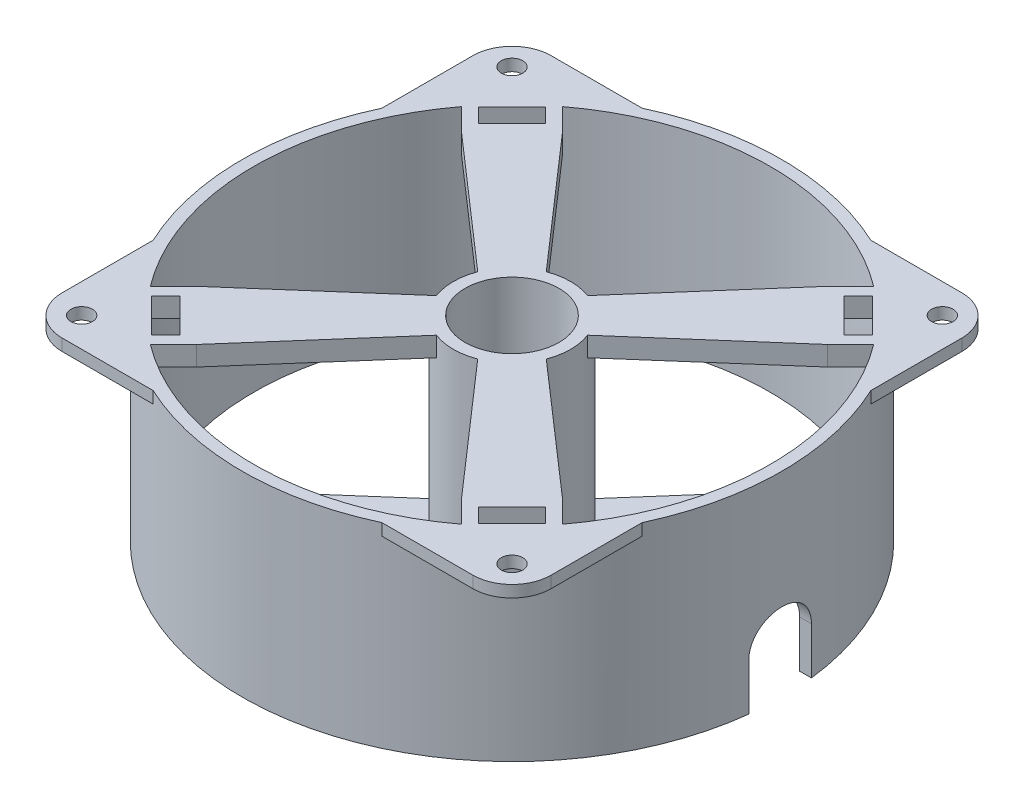
from build123d import *

# Parameters (mm, degrees)
SKETCH1_R               = 69
BOSS_EXTRUDE1_DEPTH     = 50
SKETCH2_W               = 125
SKETCH2_H               = 125
BOSS_EXTRUDE2_DEPTH     = 3
SKETCH3_R               = 2.75
CUT_EXTRUDE1_DEPTH      = 3
SKETCH4_R               = 66
CUT_EXTRUDE2_DEPTH      = 110.644881321
FILLET1_R               = 10
CUT_EXTRUDE3_DEPTH      = 110.644881321
BOSS_EXTRUDE4_DEPTH     = 50
CIRPATTERN2_COUNT       = 4
BOSS_EXTRUDE5_DEPTH     = 50
CUT_EXTRUDE4_DEPTH      = 20
CUT_EXTRUDE4_DEPTH_BACK = 20
SKETCH10_R              = 66
SKETCH11_R              = 15
BOSS_EXTRUDE6_DEPTH     = 50
SKETCH14_R              = 12
CUT_EXTRUDE6_DEPTH      = 110.644881494


with BuildPart() as part:
    # Sketch1 → Boss-Extrude1 (new body)
    with BuildSketch(Plane(origin=(0, 0, 0), x_dir=(1, 0, 0), z_dir=(0, 1, 0))):
        with Locations(Location((0, 0, 0), (0, 0, 270))):
            Circle(SKETCH1_R)
    extrude(amount=BOSS_EXTRUDE1_DEPTH)

    # Sketch2 → Boss-Extrude2 (add)
    with BuildSketch(Plane(origin=(0, 50, 0), x_dir=(1, 0, 0), z_dir=(0, 1, 0))):
        Rectangle(SKETCH2_W, SKETCH2_H)
    extrude(amount=-BOSS_EXTRUDE2_DEPTH)

    # Sketch3 → Cut-Extrude1 (cut)
    with BuildSketch(Plane(origin=(0, 50, 0), x_dir=(1, 0, 0), z_dir=(0, 1, 0))):
        with Locations(Location((55, 55, 0), (0, 0, 270))):
            Circle(SKETCH3_R)
        with Locations(Location((-55, 55, 0), (0, 0, 270))):
            Circle(SKETCH3_R)
        with Locations(Location((-55, -55, 0), (0, 0, 270))):
            Circle(SKETCH3_R)
        with Locations(Location((55, -55, 0), (0, 0, 270))):
            Circle(SKETCH3_R)
    extrude(amount=-CUT_EXTRUDE1_DEPTH, mode=Mode.SUBTRACT)

    # Sketch4 → Cut-Extrude2 (cut, through all)
    with BuildSketch(Plane.XZ):
        with Locations(Location((0, 0, 0), (0, 0, 270))):
            Circle(SKETCH4_R)
    extrude(amount=-CUT_EXTRUDE2_DEPTH, mode=Mode.SUBTRACT)

    # Fillet1
    fillet1_edges = [part.edges().sort_by_distance(p)[0] for p in [
        (-62.5, 48.5, 62.5),
        (-62.5, 48.5, -62.5),
        (62.5, 48.5, -62.5),
        (62.5, 48.5, 62.5),
    ]]
    fillet(fillet1_edges, radius=FILLET1_R)

    # Sketch6 → Cut-Extrude3 (cut, through all)
    with BuildSketch(Plane(origin=(0, 0, 0), x_dir=(0, 0, -1), z_dir=(1, 0, 0))):
        with BuildLine():
            Line((-8, 0), (-8, 12))
            ThreePointArc((-8, 12), (0, 20), (8, 12))
            Line((8, 12), (8, 0))
            ThreePointArc((8, 0), (0, -8), (-8, 0))
        make_face()
    extrude(amount=CUT_EXTRUDE3_DEPTH, mode=Mode.SUBTRACT)

    # Sketch8 → Boss-Extrude4 (add)
    with BuildSketch(Plane(origin=(0, 50, 0), x_dir=(1, 0, 0), z_dir=(0, 1, 0))):
        Polygon((41.790010768, 54.659354186), (33.870414819, 46.739758236), (46.739758236, 33.870414819), (54.659354186, 41.790010768), align=None)
        Polygon((41.790010768, 50.416713499), (50.416713499, 41.790010768), (46.739758236, 38.113055506), (38.113055506, 46.739758236), align=None, mode=Mode.SUBTRACT)
    boss_extrude4 = extrude(amount=-BOSS_EXTRUDE4_DEPTH)

    # CirPattern2: Boss-Extrude4 ×4 about axis
    cirpattern2_axis = Axis((0, 0, 0), (0, 1, 0))
    for i in range(1, CIRPATTERN2_COUNT):
        add(boss_extrude4.rotate(cirpattern2_axis, i * 360 / CIRPATTERN2_COUNT))

    # Sketch9 → Boss-Extrude5 (add)
    with BuildSketch(Plane(origin=(0, 50, 0), x_dir=(1, 0, 0), z_dir=(0, 1, 0))):
        Polygon((46.739758236, 33.870414819), (33.870414819, 46.739758236), (0, 8), (-33.870414819, 46.739758236), (-46.739758236, 33.870414819), (-8, 0), (-46.739758236, -33.870414819), (-33.870414819, -46.739758236), (0, -8), (33.870414819, -46.739758236), (46.739758236, -33.870414819), (8, 0), align=None)
    extrude(amount=-BOSS_EXTRUDE5_DEPTH)

    # Sketch10 → Cut-Extrude4 (cut, two sides: drawn at the far end of the back side and taken through both)
    with BuildSketch(Plane(origin=(0, 25, 0), x_dir=(1, 0, 0), z_dir=(0, 1, 0)).offset(-CUT_EXTRUDE4_DEPTH_BACK)):
        with Locations(Location((0, 0, 0), (0, 0, 52.925119379))):
            Circle(SKETCH10_R)
    extrude(amount=CUT_EXTRUDE4_DEPTH + CUT_EXTRUDE4_DEPTH_BACK, mode=Mode.SUBTRACT)

    # Sketch11 → Boss-Extrude6 (add)
    with BuildSketch(Plane.XZ):
        with Locations(Location((0, 0, 0), (0, 0, 290.612180744))):
            Circle(SKETCH11_R)
    extrude(amount=-BOSS_EXTRUDE6_DEPTH)

    # Sketch14 → Cut-Extrude6 (cut, through all)
    with BuildSketch(Plane(origin=(0, 50, 0), x_dir=(1, 0, 0), z_dir=(0, 1, 0))):
        with Locations(Location((0, 0, 0), (0, 0, 270))):
            Circle(SKETCH14_R)
    extrude(amount=-CUT_EXTRUDE6_DEPTH, mode=Mode.SUBTRACT)


solid = part.part
